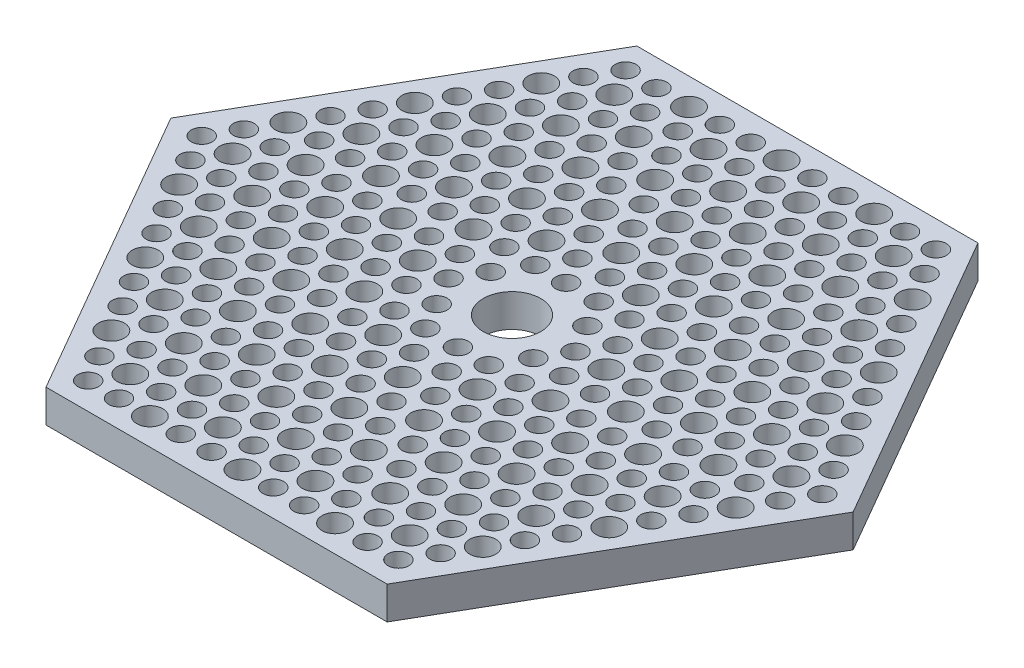
from build123d import *

# Parameters (mm, degrees)
BOSS_EXTRUDE2_DEPTH   = 20
SKETCH1_8_OUTSIDE_W   = 527.746
SKETCH1_8_OUTSIDE_H   = 472.054
SKETCH1_8_OUTSIDE_R   = 6.35
SKETCH1_8_OUTSIDE_R_2 = 7.94
CUT_EXTRUDE3_DEPTH    = 276.680975042
SKETCH3_R             = 17.5
CUT_EXTRUDE4_DEPTH    = 276.680975042
CIRPATTERN1_COUNT     = 6


with BuildPart() as part:
    # Sketch1 → Boss-Extrude2 (new body)
    with BuildSketch(Plane(origin=(0, 0, 0), x_dir=(1, 0, 0), z_dir=(0, 1, 0))):
        Polygon((-207.846096908, 0), (-103.923048454, -180), (103.923048454, -180), (207.846096908, 0), (103.923048454, 180), (-103.923048454, 180), align=None)
    extrude(amount=-BOSS_EXTRUDE2_DEPTH)

    # Sketch1<8> outside → Cut-Extrude3 (cut, through all)
    # profile 1 of 55: a face of its own
    with BuildSketch(Plane(origin=(0, 0, 0), x_dir=(1, 0, 0), z_dir=(0, 1, 0))):
        Rectangle(SKETCH1_8_OUTSIDE_W, SKETCH1_8_OUTSIDE_H)
        Polygon((-207.846096908, 0), (-103.923048454, -180), (103.923048454, -180), (207.846096908, 0), (103.923048454, 180), (-103.923048454, 180), align=None, mode=Mode.SUBTRACT)
    # profile 2 of 55: a face of its own
    with BuildSketch(Plane(origin=(0, 0, 0), x_dir=(1, 0, 0), z_dir=(0, 1, 0))):
        with Locations((-94.523048454, -163.718722409)):
            Circle(SKETCH1_8_OUTSIDE_R)
    # profile 3 of 55: a face of its own
    with BuildSketch(Plane(origin=(0, 0, 0), x_dir=(1, 0, 0), z_dir=(0, 1, 0))):
        with Locations((-85.123048454, -147.437444818)):
            Circle(SKETCH1_8_OUTSIDE_R_2)
    # profile 4 of 55: a face of its own
    with BuildSketch(Plane(origin=(0, 0, 0), x_dir=(1, 0, 0), z_dir=(0, 1, 0))):
        with Locations((-103.923048454, -147.437444818)):
            Circle(SKETCH1_8_OUTSIDE_R)
    # profile 5 of 55: a face of its own
    with BuildSketch(Plane(origin=(0, 0, 0), x_dir=(1, 0, 0), z_dir=(0, 1, 0))):
        with Locations((-94.523048454, -131.156167227)):
            Circle(SKETCH1_8_OUTSIDE_R)
    # profile 6 of 55: a face of its own
    with BuildSketch(Plane(origin=(0, 0, 0), x_dir=(1, 0, 0), z_dir=(0, 1, 0))):
        with Locations((-75.723048454, -131.156167227)):
            Circle(SKETCH1_8_OUTSIDE_R)
    # profile 7 of 55: a face of its own
    with BuildSketch(Plane(origin=(0, 0, 0), x_dir=(1, 0, 0), z_dir=(0, 1, 0))):
        with Locations((-66.323048454, -147.437444818)):
            Circle(SKETCH1_8_OUTSIDE_R)
    # profile 8 of 55: a face of its own
    with BuildSketch(Plane(origin=(0, 0, 0), x_dir=(1, 0, 0), z_dir=(0, 1, 0))):
        with Locations((-75.723048454, -163.718722409)):
            Circle(SKETCH1_8_OUTSIDE_R)
    # profile 9 of 55: a face of its own
    with BuildSketch(Plane(origin=(0, 0, 0), x_dir=(1, 0, 0), z_dir=(0, 1, 0))):
        with Locations((-47.523048454, -82.312334453)):
            Circle(SKETCH1_8_OUTSIDE_R)
    # profile 10 of 55: a face of its own
    with BuildSketch(Plane(origin=(0, 0, 0), x_dir=(1, 0, 0), z_dir=(0, 1, 0))):
        with Locations((-38.123048454, -98.593612044)):
            Circle(SKETCH1_8_OUTSIDE_R)
    # profile 11 of 55: a face of its own
    with BuildSketch(Plane(origin=(0, 0, 0), x_dir=(1, 0, 0), z_dir=(0, 1, 0))):
        with Locations((-66.323048454, -82.312334453)):
            Circle(SKETCH1_8_OUTSIDE_R)
    # profile 12 of 55: a face of its own
    with BuildSketch(Plane(origin=(0, 0, 0), x_dir=(1, 0, 0), z_dir=(0, 1, 0))):
        with Locations((-75.723048454, -98.593612044)):
            Circle(SKETCH1_8_OUTSIDE_R)
    # profile 13 of 55: a face of its own
    with BuildSketch(Plane(origin=(0, 0, 0), x_dir=(1, 0, 0), z_dir=(0, 1, 0))):
        with Locations((-56.923048454, -98.593612044)):
            Circle(SKETCH1_8_OUTSIDE_R_2)
    # profile 14 of 55: a face of its own
    with BuildSketch(Plane(origin=(0, 0, 0), x_dir=(1, 0, 0), z_dir=(0, 1, 0))):
        with Locations((-66.323048454, -114.874889635)):
            Circle(SKETCH1_8_OUTSIDE_R)
    # profile 15 of 55: a face of its own
    with BuildSketch(Plane(origin=(0, 0, 0), x_dir=(1, 0, 0), z_dir=(0, 1, 0))):
        with Locations((-47.523048454, -114.874889635)):
            Circle(SKETCH1_8_OUTSIDE_R)
    # profile 16 of 55: a face of its own
    with BuildSketch(Plane(origin=(0, 0, 0), x_dir=(1, 0, 0), z_dir=(0, 1, 0))):
        with Locations((-19.323048454, -33.46850168)):
            Circle(SKETCH1_8_OUTSIDE_R)
    # profile 17 of 55: a face of its own
    with BuildSketch(Plane(origin=(0, 0, 0), x_dir=(1, 0, 0), z_dir=(0, 1, 0))):
        with Locations((-9.923048454, -49.749779271)):
            Circle(SKETCH1_8_OUTSIDE_R)
    # profile 18 of 55: a face of its own
    with BuildSketch(Plane(origin=(0, 0, 0), x_dir=(1, 0, 0), z_dir=(0, 1, 0))):
        with Locations((-38.123048454, -33.46850168)):
            Circle(SKETCH1_8_OUTSIDE_R)
    # profile 19 of 55: a face of its own
    with BuildSketch(Plane(origin=(0, 0, 0), x_dir=(1, 0, 0), z_dir=(0, 1, 0))):
        with Locations((-47.523048454, -49.749779271)):
            Circle(SKETCH1_8_OUTSIDE_R)
    # profile 20 of 55: a face of its own
    with BuildSketch(Plane(origin=(0, 0, 0), x_dir=(1, 0, 0), z_dir=(0, 1, 0))):
        with Locations((-28.723048454, -49.749779271)):
            Circle(SKETCH1_8_OUTSIDE_R_2)
    # profile 21 of 55: a face of its own
    with BuildSketch(Plane(origin=(0, 0, 0), x_dir=(1, 0, 0), z_dir=(0, 1, 0))):
        with Locations((-38.123048454, -66.031056862)):
            Circle(SKETCH1_8_OUTSIDE_R)
    # profile 22 of 55: a face of its own
    with BuildSketch(Plane(origin=(0, 0, 0), x_dir=(1, 0, 0), z_dir=(0, 1, 0))):
        with Locations((-19.323048454, -66.031056862)):
            Circle(SKETCH1_8_OUTSIDE_R)
    # profile 23 of 55: a face of its own
    with BuildSketch(Plane(origin=(0, 0, 0), x_dir=(1, 0, 0), z_dir=(0, 1, 0))):
        with Locations((-28.723048454, -147.437444818)):
            Circle(SKETCH1_8_OUTSIDE_R_2)
    # profile 24 of 55: a face of its own
    with BuildSketch(Plane(origin=(0, 0, 0), x_dir=(1, 0, 0), z_dir=(0, 1, 0))):
        with Locations((-9.923048454, -147.437444818)):
            Circle(SKETCH1_8_OUTSIDE_R)
    # profile 25 of 55: a face of its own
    with BuildSketch(Plane(origin=(0, 0, 0), x_dir=(1, 0, 0), z_dir=(0, 1, 0))):
        with Locations((-19.323048454, -163.718722409)):
            Circle(SKETCH1_8_OUTSIDE_R)
    # profile 26 of 55: a face of its own
    with BuildSketch(Plane(origin=(0, 0, 0), x_dir=(1, 0, 0), z_dir=(0, 1, 0))):
        with Locations((-38.123048454, -163.718722409)):
            Circle(SKETCH1_8_OUTSIDE_R)
    # profile 27 of 55: a face of its own
    with BuildSketch(Plane(origin=(0, 0, 0), x_dir=(1, 0, 0), z_dir=(0, 1, 0))):
        with Locations((-47.523048454, -147.437444818)):
            Circle(SKETCH1_8_OUTSIDE_R)
    # profile 28 of 55: a face of its own
    with BuildSketch(Plane(origin=(0, 0, 0), x_dir=(1, 0, 0), z_dir=(0, 1, 0))):
        with Locations((-38.123048454, -131.156167227)):
            Circle(SKETCH1_8_OUTSIDE_R)
    # profile 29 of 55: a face of its own
    with BuildSketch(Plane(origin=(0, 0, 0), x_dir=(1, 0, 0), z_dir=(0, 1, 0))):
        with Locations((-19.323048454, -131.156167227)):
            Circle(SKETCH1_8_OUTSIDE_R)
    # profile 30 of 55: a face of its own
    with BuildSketch(Plane(origin=(0, 0, 0), x_dir=(1, 0, 0), z_dir=(0, 1, 0))):
        with Locations((27.676951546, -147.437444818)):
            Circle(SKETCH1_8_OUTSIDE_R_2)
    # profile 31 of 55: a face of its own
    with BuildSketch(Plane(origin=(0, 0, 0), x_dir=(1, 0, 0), z_dir=(0, 1, 0))):
        with Locations((46.476951546, -147.437444818)):
            Circle(SKETCH1_8_OUTSIDE_R)
    # profile 32 of 55: a face of its own
    with BuildSketch(Plane(origin=(0, 0, 0), x_dir=(1, 0, 0), z_dir=(0, 1, 0))):
        with Locations((37.076951546, -163.718722409)):
            Circle(SKETCH1_8_OUTSIDE_R)
    # profile 33 of 55: a face of its own
    with BuildSketch(Plane(origin=(0, 0, 0), x_dir=(1, 0, 0), z_dir=(0, 1, 0))):
        with Locations((18.276951546, -163.718722409)):
            Circle(SKETCH1_8_OUTSIDE_R)
    # profile 34 of 55: a face of its own
    with BuildSketch(Plane(origin=(0, 0, 0), x_dir=(1, 0, 0), z_dir=(0, 1, 0))):
        with Locations((8.876951546, -147.437444818)):
            Circle(SKETCH1_8_OUTSIDE_R)
    # profile 35 of 55: a face of its own
    with BuildSketch(Plane(origin=(0, 0, 0), x_dir=(1, 0, 0), z_dir=(0, 1, 0))):
        with Locations((18.276951546, -131.156167227)):
            Circle(SKETCH1_8_OUTSIDE_R)
    # profile 36 of 55: a face of its own
    with BuildSketch(Plane(origin=(0, 0, 0), x_dir=(1, 0, 0), z_dir=(0, 1, 0))):
        with Locations((37.076951546, -131.156167227)):
            Circle(SKETCH1_8_OUTSIDE_R)
    # profile 37 of 55: a face of its own
    with BuildSketch(Plane(origin=(0, 0, 0), x_dir=(1, 0, 0), z_dir=(0, 1, 0))):
        with Locations((-0.523048454, -98.593612044)):
            Circle(SKETCH1_8_OUTSIDE_R_2)
    # profile 38 of 55: a face of its own
    with BuildSketch(Plane(origin=(0, 0, 0), x_dir=(1, 0, 0), z_dir=(0, 1, 0))):
        with Locations((18.276951546, -98.593612044)):
            Circle(SKETCH1_8_OUTSIDE_R)
    # profile 39 of 55: a face of its own
    with BuildSketch(Plane(origin=(0, 0, 0), x_dir=(1, 0, 0), z_dir=(0, 1, 0))):
        with Locations((8.876951546, -82.312334453)):
            Circle(SKETCH1_8_OUTSIDE_R)
    # profile 40 of 55: a face of its own
    with BuildSketch(Plane(origin=(0, 0, 0), x_dir=(1, 0, 0), z_dir=(0, 1, 0))):
        with Locations((-9.923048454, -82.312334453)):
            Circle(SKETCH1_8_OUTSIDE_R)
    # profile 41 of 55: a face of its own
    with BuildSketch(Plane(origin=(0, 0, 0), x_dir=(1, 0, 0), z_dir=(0, 1, 0))):
        with Locations((-19.323048454, -98.593612044)):
            Circle(SKETCH1_8_OUTSIDE_R)
    # profile 42 of 55: a face of its own
    with BuildSketch(Plane(origin=(0, 0, 0), x_dir=(1, 0, 0), z_dir=(0, 1, 0))):
        with Locations((-9.923048454, -114.874889635)):
            Circle(SKETCH1_8_OUTSIDE_R)
    # profile 43 of 55: a face of its own
    with BuildSketch(Plane(origin=(0, 0, 0), x_dir=(1, 0, 0), z_dir=(0, 1, 0))):
        with Locations((8.876951546, -114.874889635)):
            Circle(SKETCH1_8_OUTSIDE_R)
    # profile 44 of 55: a face of its own
    with BuildSketch(Plane(origin=(0, 0, 0), x_dir=(1, 0, 0), z_dir=(0, 1, 0))):
        with Locations((-56.923048454, -131.156167227)):
            Circle(SKETCH1_8_OUTSIDE_R_2)
    # profile 45 of 55: a face of its own
    with BuildSketch(Plane(origin=(0, 0, 0), x_dir=(1, 0, 0), z_dir=(0, 1, 0))):
        with Locations((-56.923048454, -163.718722409)):
            Circle(SKETCH1_8_OUTSIDE_R_2)
    # profile 46 of 55: a face of its own
    with BuildSketch(Plane(origin=(0, 0, 0), x_dir=(1, 0, 0), z_dir=(0, 1, 0))):
        with Locations((-0.523048454, -163.718722409)):
            Circle(SKETCH1_8_OUTSIDE_R_2)
    # profile 47 of 55: a face of its own
    with BuildSketch(Plane(origin=(0, 0, 0), x_dir=(1, 0, 0), z_dir=(0, 1, 0))):
        with Locations((55.876951546, -163.718722409)):
            Circle(SKETCH1_8_OUTSIDE_R_2)
    # profile 48 of 55: a face of its own
    with BuildSketch(Plane(origin=(0, 0, 0), x_dir=(1, 0, 0), z_dir=(0, 1, 0))):
        with Locations((27.676951546, -114.874889635)):
            Circle(SKETCH1_8_OUTSIDE_R_2)
    # profile 49 of 55: a face of its own
    with BuildSketch(Plane(origin=(0, 0, 0), x_dir=(1, 0, 0), z_dir=(0, 1, 0))):
        with Locations((-0.523048454, -131.156167227)):
            Circle(SKETCH1_8_OUTSIDE_R_2)
    # profile 50 of 55: a face of its own
    with BuildSketch(Plane(origin=(0, 0, 0), x_dir=(1, 0, 0), z_dir=(0, 1, 0))):
        with Locations((-28.723048454, -82.312334453)):
            Circle(SKETCH1_8_OUTSIDE_R_2)
    # profile 51 of 55: a face of its own
    with BuildSketch(Plane(origin=(0, 0, 0), x_dir=(1, 0, 0), z_dir=(0, 1, 0))):
        with Locations((-28.723048454, -114.874889635)):
            Circle(SKETCH1_8_OUTSIDE_R_2)
    # profile 52 of 55: a face of its own
    with BuildSketch(Plane(origin=(0, 0, 0), x_dir=(1, 0, 0), z_dir=(0, 1, 0))):
        with Locations((-85.123048454, -114.874889635)):
            Circle(SKETCH1_8_OUTSIDE_R_2)
    # profile 53 of 55: a face of its own
    with BuildSketch(Plane(origin=(0, 0, 0), x_dir=(1, 0, 0), z_dir=(0, 1, 0))):
        with Locations((-56.923048454, -66.031056862)):
            Circle(SKETCH1_8_OUTSIDE_R_2)
    # profile 54 of 55: a face of its own
    with BuildSketch(Plane(origin=(0, 0, 0), x_dir=(1, 0, 0), z_dir=(0, 1, 0))):
        with Locations((-0.523048454, -66.031056862)):
            Circle(SKETCH1_8_OUTSIDE_R_2)
    # profile 55 of 55: a face of its own
    with BuildSketch(Plane(origin=(0, 0, 0), x_dir=(1, 0, 0), z_dir=(0, 1, 0))):
        with Locations((-28.723048454, -17.187224089)):
            Circle(SKETCH1_8_OUTSIDE_R)
    cut_extrude3 = extrude(amount=-CUT_EXTRUDE3_DEPTH, mode=Mode.SUBTRACT)

    # Sketch3 → Cut-Extrude4 (cut, through all)
    with BuildSketch(Plane(origin=(0, 0, 0), x_dir=(1, 0, 0), z_dir=(0, 1, 0))):
        Circle(SKETCH3_R)
    extrude(amount=-CUT_EXTRUDE4_DEPTH, mode=Mode.SUBTRACT)

    # CirPattern1: Cut-Extrude3 ×6 about axis
    cirpattern1_axis = Axis((0, 0, 0), (0, 1, 0))
    for i in range(1, CIRPATTERN1_COUNT):
        add(cut_extrude3.rotate(cirpattern1_axis, i * 360 / CIRPATTERN1_COUNT), mode=Mode.SUBTRACT)


solid = part.part
